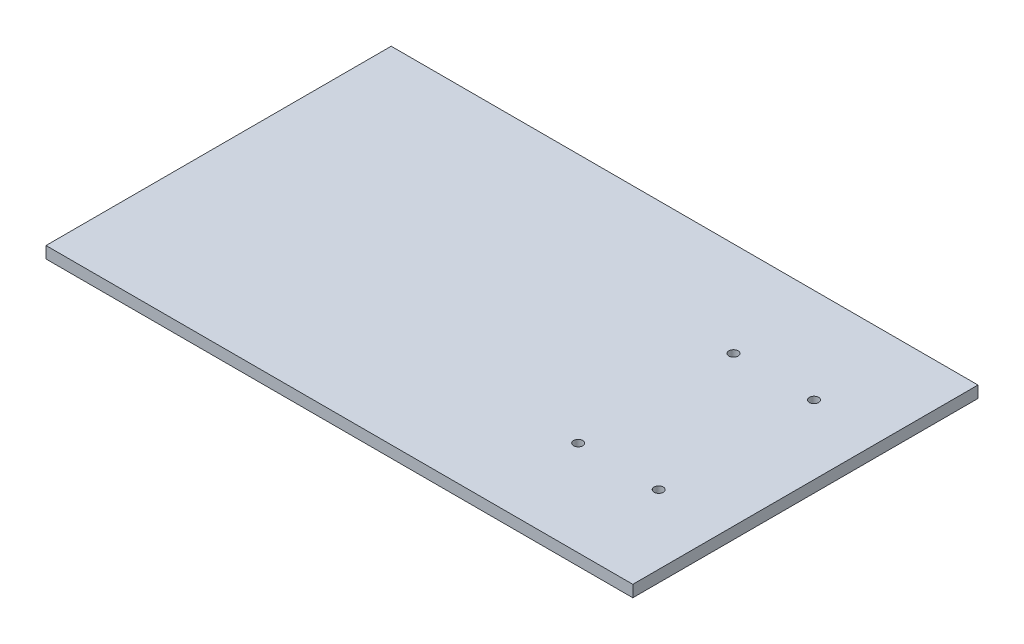
from build123d import *

# Parameters (mm, degrees)
SKETCH1_W           = 510
SKETCH1_H           = 300
BOSS_EXTRUDE1_DEPTH = 10.16
SKETCH2_R           = 4
CUT_EXTRUDE1_DEPTH  = 592.779710365


with BuildPart() as part:
    # Sketch1 → Boss-Extrude1 (new body)
    with BuildSketch(Plane(origin=(0, 0, 0), x_dir=(1, 0, 0), z_dir=(0, 1, 0))):
        with Locations((255, 150)):
            Rectangle(SKETCH1_W, SKETCH1_H)
    extrude(amount=BOSS_EXTRUDE1_DEPTH)

    # Sketch2 → Cut-Extrude1 (cut, through all)
    with BuildSketch(Plane.XZ):
        with Locations(Location((380, -217.5, 0), (0, 0, 270))):
            Circle(SKETCH2_R)
        with Locations(Location((380, -82.5, 0), (0, 0, 270))):
            Circle(SKETCH2_R)
        with Locations(Location((450, -82.5, 0), (0, 0, 270))):
            Circle(SKETCH2_R)
        with Locations(Location((450, -217.5, 0), (0, 0, 270))):
            Circle(SKETCH2_R)
    extrude(amount=-CUT_EXTRUDE1_DEPTH, mode=Mode.SUBTRACT)


solid = part.part
